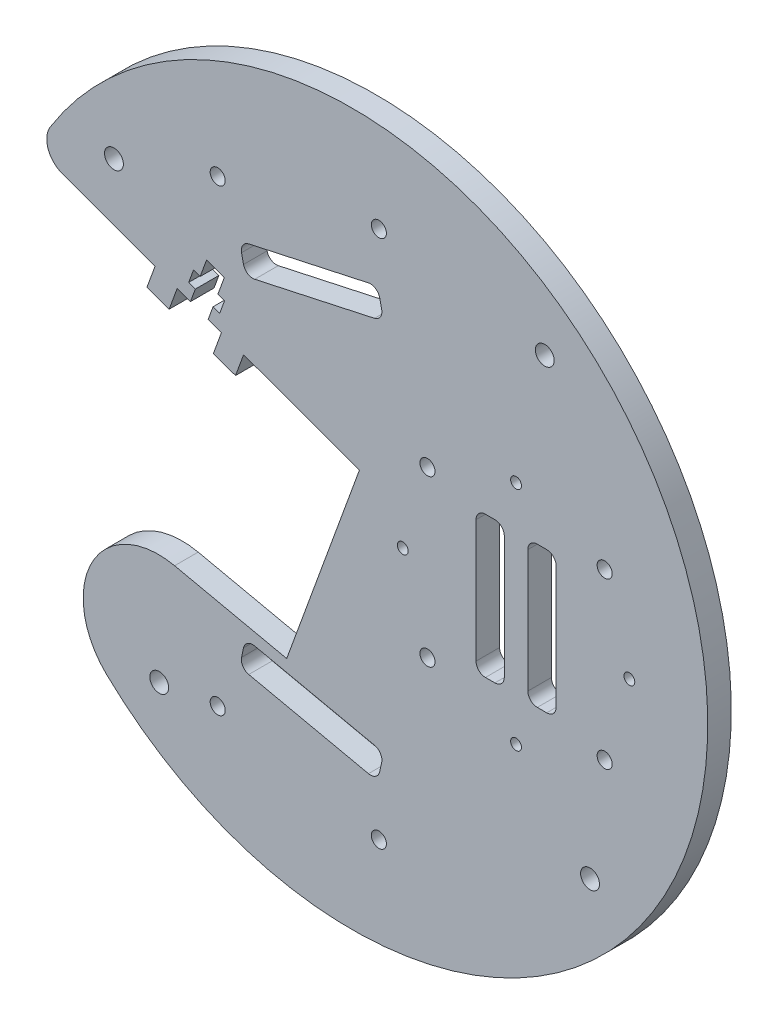
from build123d import *

# Parameters (mm, degrees)
ESQUISSE1_R        = 2
ESQUISSE1_R_2      = 1.6
ESQUISSE1_R_3      = 1.15
BOSS_EXTRU_1_DEPTH = 5
CONG_1_R           = 16
CONG_2_R           = 5


with BuildPart() as part:
    # Esquisse1 → Boss.-Extru.1 (new body)
    with BuildSketch(Plane.XY):
        with BuildLine():
            Line((-41.789550091, 25.514872575), (-67.043743505, 34.718675909))
            ThreePointArc((-67.043743505, 34.718675909), (75.07344073, -8.014268337), (-72.8619706, -19.783408206))
            Line((-72.8619706, -19.783408206), (-13.85803971, -32.618894281))
            Line((-13.85803971, -32.618894281), (1.569593433, 9.712782871))
            Line((1.569593433, 9.712782871), (-22.998575873, 18.666567095))
            Line((-22.998575873, 18.666567095), (-24.710652243, 13.96882354))
            Line((-24.710652243, 13.96882354), (-29.408395797, 15.68089991))
            Line((-29.408395797, 15.68089991), (-27.696319427, 20.378643465))
            Line((-27.696319427, 20.378643465), (-30.51496556, 21.405889287))
            Line((-30.51496556, 21.405889287), (-29.487719738, 24.224535419))
            Line((-29.487719738, 24.224535419), (-28.078396672, 23.710912508))
            Line((-28.078396672, 23.710912508), (-27.05115085, 26.529558641))
            Line((-27.05115085, 26.529558641), (-28.460473916, 27.043181552))
            Line((-28.460473916, 27.043181552), (-27.09081282, 30.801376396))
            Line((-27.09081282, 30.801376396), (-30.849007664, 32.171037492))
            Line((-30.849007664, 32.171037492), (-32.21866876, 28.412842648))
            Line((-32.21866876, 28.412842648), (-33.627991826, 28.926465559))
            Line((-33.627991826, 28.926465559), (-34.655237648, 26.107819426))
            Line((-34.655237648, 26.107819426), (-33.245914582, 25.594196515))
            Line((-33.245914582, 25.594196515), (-34.273160404, 22.775550383))
            Line((-34.273160404, 22.775550383), (-37.091806536, 23.802796205))
            Line((-37.091806536, 23.802796205), (-38.803882906, 19.10505265))
            Line((-38.803882906, 19.10505265), (-43.501626461, 20.81712902))
            Line((-43.501626461, 20.81712902), (-41.789550091, 25.514872575))
        make_face()
        with Locations((40.905825418, 50.514487495)):
            Circle(ESQUISSE1_R, mode=Mode.SUBTRACT)
        with Locations((-50.514487495, 40.905825418)):
            Circle(ESQUISSE1_R, mode=Mode.SUBTRACT)
        with Locations((50.514487495, -40.905825418)):
            Circle(ESQUISSE1_R, mode=Mode.SUBTRACT)
        with Locations((-40.905825418, -50.514487495)):
            Circle(ESQUISSE1_R, mode=Mode.SUBTRACT)
        with Locations((-28.497621404, 48.673941395)):
            Circle(ESQUISSE1_R_2, mode=Mode.SUBTRACT)
        with Locations((5.702522929, 56.11370803)):
            Circle(ESQUISSE1_R_2, mode=Mode.SUBTRACT)
        with Locations((5.702522929, -56.11370803)):
            Circle(ESQUISSE1_R_2, mode=Mode.SUBTRACT)
        with Locations((-28.497621404, -48.673941395)):
            Circle(ESQUISSE1_R_2, mode=Mode.SUBTRACT)
        with Locations((53.619184968, 17.5)):
            Circle(ESQUISSE1_R_2, mode=Mode.SUBTRACT)
        with Locations((53.619184968, -17.5)):
            Circle(ESQUISSE1_R_2, mode=Mode.SUBTRACT)
        with Locations((16.019184968, -17.5)):
            Circle(ESQUISSE1_R_2, mode=Mode.SUBTRACT)
        with Locations((16.019184968, 17.5)):
            Circle(ESQUISSE1_R_2, mode=Mode.SUBTRACT)
        with Locations((10.777554407, 0)):
            Circle(ESQUISSE1_R_3, mode=Mode.SUBTRACT)
        with Locations((34.819184968, 24.04163056)):
            Circle(ESQUISSE1_R_3, mode=Mode.SUBTRACT)
        with Locations((58.860815528, 0)):
            Circle(ESQUISSE1_R_3, mode=Mode.SUBTRACT)
        with Locations((34.819184968, -24.04163056)):
            Circle(ESQUISSE1_R_3, mode=Mode.SUBTRACT)
        with BuildLine():
            Line((-23.015077869, 35.23215147), (-23.440207391, 37.186445432))
            ThreePointArc((-23.440207391, 37.186445432), (-23.16841991, 38.692857499), (-21.911042951, 39.565868916))
            Line((-21.911042951, 39.565868916), (3.494778553, 45.092552701))
            ThreePointArc((3.494778553, 45.092552701), (5.00119062, 44.82076522), (5.874202037, 43.563388261))
            Line((5.874202037, 43.563388261), (6.299331559, 41.6090943))
            ThreePointArc((6.299331559, 41.6090943), (6.027544078, 40.102682233), (4.770167119, 39.229670816))
            Line((4.770167119, 39.229670816), (-20.635654385, 33.70298703))
            ThreePointArc((-20.635654385, 33.70298703), (-22.142066452, 33.974774511), (-23.015077869, 35.23215147))
        make_face(mode=Mode.SUBTRACT)
        with BuildLine():
            Line((6.299331559, -41.6090943), (5.874202037, -43.563388261))
            ThreePointArc((5.874202037, -43.563388261), (5.00119062, -44.82076522), (3.494778553, -45.092552701))
            Line((3.494778553, -45.092552701), (-21.911042951, -39.565868916))
            ThreePointArc((-21.911042951, -39.565868916), (-23.16841991, -38.692857499), (-23.440207391, -37.186445432))
            Line((-23.440207391, -37.186445432), (-23.015077869, -35.23215147))
            ThreePointArc((-23.015077869, -35.23215147), (-22.142066452, -33.974774511), (-20.635654385, -33.70298703))
            Line((-20.635654385, -33.70298703), (4.770167119, -39.229670816))
            ThreePointArc((4.770167119, -39.229670816), (6.027544078, -40.102682233), (6.299331559, -41.6090943))
        make_face(mode=Mode.SUBTRACT)
        with BuildLine():
            Line((39.319184968, 15), (41.319184968, 15))
            ThreePointArc((41.319184968, 15), (42.73339853, 14.414213562), (43.319184968, 13))
            Line((43.319184968, 13), (43.319184968, -13))
            ThreePointArc((43.319184968, -13), (42.73339853, -14.414213562), (41.319184968, -15))
            Line((41.319184968, -15), (39.319184968, -15))
            ThreePointArc((39.319184968, -15), (37.904971405, -14.414213562), (37.319184968, -13))
            Line((37.319184968, -13), (37.319184968, 13))
            ThreePointArc((37.319184968, 13), (37.904971405, 14.414213562), (39.319184968, 15))
        make_face(mode=Mode.SUBTRACT)
        with BuildLine():
            Line((30.319184968, -15), (28.319184968, -15))
            ThreePointArc((28.319184968, -15), (26.904971405, -14.414213562), (26.319184968, -13))
            Line((26.319184968, -13), (26.319184968, 13))
            ThreePointArc((26.319184968, 13), (26.904971405, 14.414213562), (28.319184968, 15))
            Line((28.319184968, 15), (30.319184968, 15))
            ThreePointArc((30.319184968, 15), (31.73339853, 14.414213562), (32.319184968, 13))
            Line((32.319184968, 13), (32.319184968, -13))
            ThreePointArc((32.319184968, -13), (31.73339853, -14.414213562), (30.319184968, -15))
        make_face(mode=Mode.SUBTRACT)
    extrude(amount=BOSS_EXTRU_1_DEPTH)

    # Congé1
    cong_1_edges = [part.edges().sort_by_distance(p)[0] for p in [
        (-72.8619706, -19.783408206, 2.5),
    ]]
    fillet(cong_1_edges, radius=CONG_1_R)

    # Congé2
    cong_2_edges = [part.edges().sort_by_distance(p)[0] for p in [
        (-67.043743505, 34.718675909, 2.5),
    ]]
    fillet(cong_2_edges, radius=CONG_2_R)


solid = part.part
